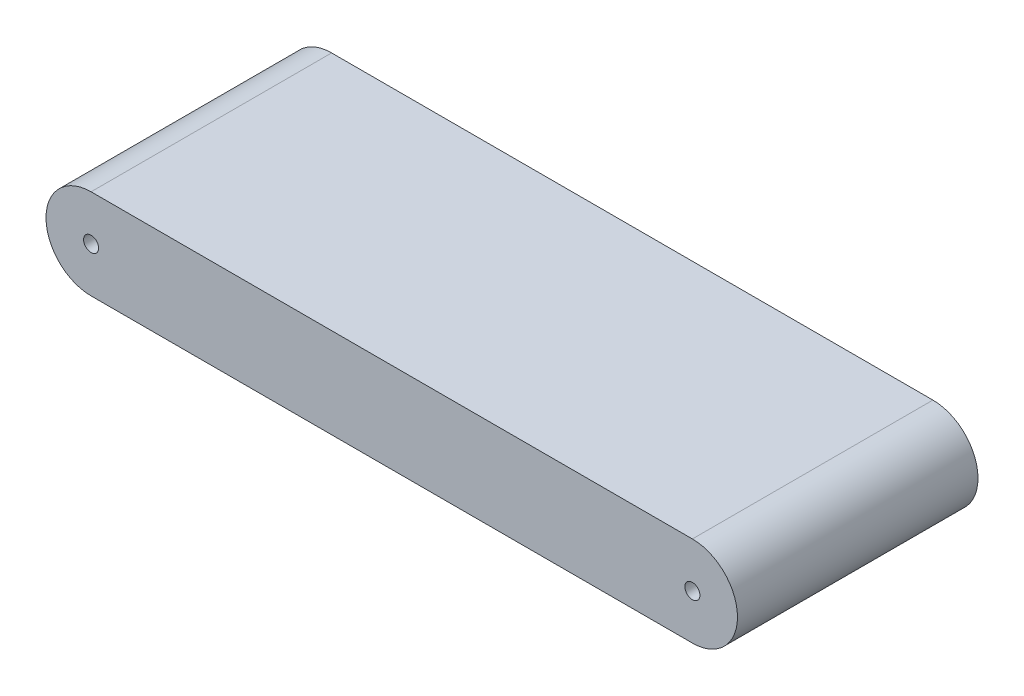
from build123d import *

# Parameters (mm, degrees)
EXTRUDE_1_DEPTH          = 80
CUT_EXTRUDE_1_DEPTH      = 141.890028036
CUT_EXTRUDE_1_DEPTH_BACK = 141.890028036
SKETCH_2_R               = 2.5


with BuildPart() as part:
    # 草图1 → 凸台-拉伸1 (new body)
    with BuildSketch(Plane.XY):
        with BuildLine():
            Line((-100, 15), (100, 15))
            ThreePointArc((100, 15), (115, 0), (100, -15))
            Line((100, -15), (-100, -15))
            ThreePointArc((-100, -15), (-115, 0), (-100, 15))
        make_face()
    extrude(amount=EXTRUDE_1_DEPTH)

    # 草图2 → 切除-拉伸1 (cut, two sides: drawn at the far end of the back side and taken through both)
    with BuildSketch(Plane.XY.offset(80).offset(-CUT_EXTRUDE_1_DEPTH_BACK)):
        with Locations((-100, 0)):
            Circle(SKETCH_2_R)
        with Locations((100, 0)):
            Circle(SKETCH_2_R)
    extrude(amount=CUT_EXTRUDE_1_DEPTH + CUT_EXTRUDE_1_DEPTH_BACK, mode=Mode.SUBTRACT)


solid = part.part
